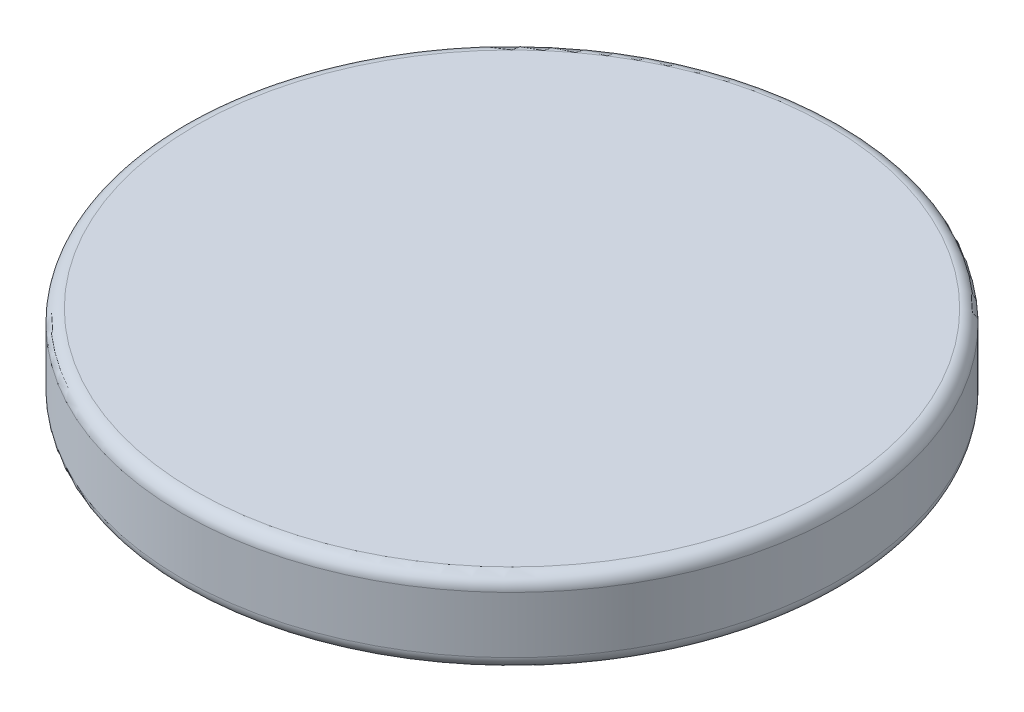
from build123d import *

# Parameters (mm, degrees)
SKETCH2_R           = 6.35
BOSS_EXTRUDE1_DEPTH = 1.5875
FILLET1_R           = 0.25


with BuildPart() as part:
    # Sketch2 → Boss-Extrude1 (new body)
    with BuildSketch(Plane(origin=(0, 0, 0), x_dir=(1, 0, 0), z_dir=(0, 1, 0))):
        with Locations(Location((0, 0, 0), (0, 0, 270))):
            Circle(SKETCH2_R)
    extrude(amount=BOSS_EXTRUDE1_DEPTH)

    # Fillet1
    fillet1_edges = [part.edges().sort_by_distance(p)[0] for p in [
        (0, 0, -6.35),
        (0, 1.5875, -6.35),
    ]]
    fillet(fillet1_edges, radius=FILLET1_R)


solid = part.part
